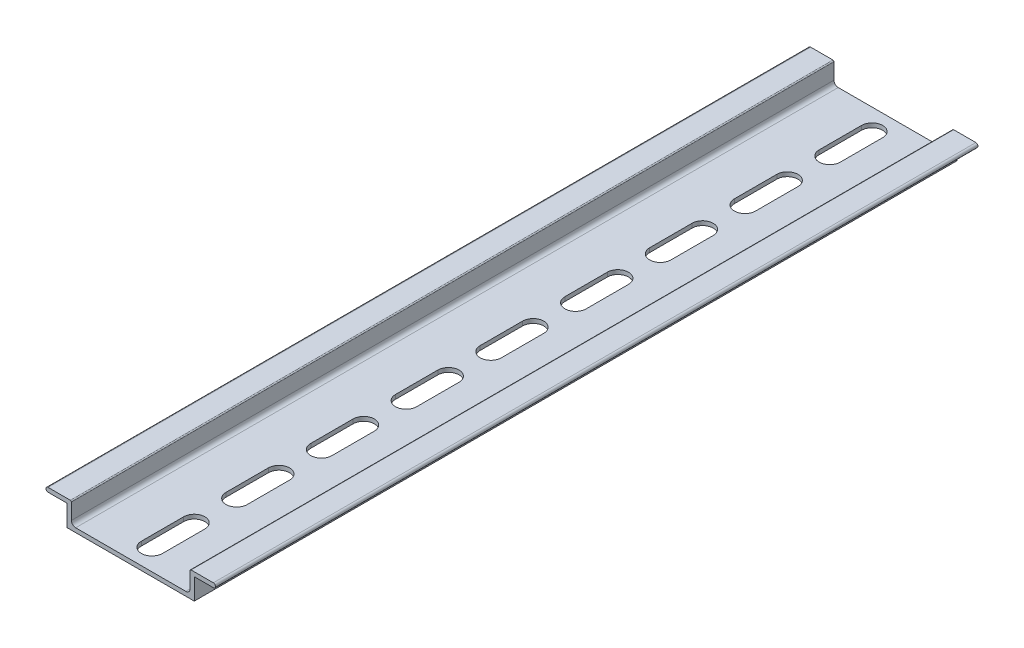
from build123d import *

# Parameters (mm, degrees)
EXTRUDE_THIN1_DEPTH = 90
FILLET1_R           = 1
FILLET2_R           = 0.25
FILLET3_RADIUS      = 0.5
FILLET3_LENGTH      = 180
FILLET4_RADIUS      = 0.5
FILLET4_LENGTH      = 180
CUT_EXTRUDE1_DEPTH  = 93.330926563
LPATTERN1_COUNT     = 5
LPATTERN1_PITCH     = 20
LPATTERN1_COL_COUNT = 5
LPATTERN1_COL_PITCH = 20


with BuildPart() as part:
    # Sketch1 → Extrude-Thin1 (new, symmetric)
    with BuildSketch(Plane.XY):
        Polygon((-20, 5), (-15, 5), (-15, 0), (15, 0), (15, 5), (20, 5), (20, 6), (14, 6), (14, 1), (-14, 1), (-14, 6), (-20, 6), align=None)
    extrude(amount=EXTRUDE_THIN1_DEPTH, both=True)

    # Fillet1
    fillet1_edges = [part.edges().sort_by_distance(p)[0] for p in [
        (-14, 1, 0),
        (14, 1, 0),
    ]]
    fillet(fillet1_edges, radius=FILLET1_R)

    # Fillet2
    fillet2_edges = [part.edges().sort_by_distance(p)[0] for p in [
        (-14, 6, 0),
        (14, 6, 0),
    ]]
    fillet(fillet2_edges, radius=FILLET2_R)

    # Fillet3: full round fillet: the end face becomes a half cylinder, R = half its width
    fillet3_face = Plane((20, 5.5, 0), x_dir=(0, 0, 1), z_dir=(1, 0, 0))  # on the end face: x along it, z out of the body
    fillet3_slab = fillet3_face.offset(-FILLET3_RADIUS / 2) * Box(FILLET3_LENGTH, 2 * FILLET3_RADIUS, FILLET3_RADIUS, mode=Mode.PRIVATE)  # the body's end, R deep
    fillet3_round = Plane((19.5, 5.5, 0), x_dir=(1, 0, 0), z_dir=(0, 0, 1)) * Cylinder(FILLET3_RADIUS, FILLET3_LENGTH, mode=Mode.PRIVATE)  # its axis R under the face
    add(fillet3_slab - fillet3_round, mode=Mode.SUBTRACT)

    # Fillet4: full round fillet: the end face becomes a half cylinder, R = half its width
    fillet4_face = Plane((-20, 5.5, 0), x_dir=(0, 0, 1), z_dir=(-1, 0, 0))  # on the end face: x along it, z out of the body
    fillet4_slab = fillet4_face.offset(-FILLET4_RADIUS / 2) * Box(FILLET4_LENGTH, 2 * FILLET4_RADIUS, FILLET4_RADIUS, mode=Mode.PRIVATE)  # the body's end, R deep
    fillet4_round = Plane((-19.5, 5.5, 0), x_dir=(-1, 0, 0), z_dir=(0, 0, 1)) * Cylinder(FILLET4_RADIUS, FILLET4_LENGTH, mode=Mode.PRIVATE)  # its axis R under the face
    add(fillet4_slab - fillet4_round, mode=Mode.SUBTRACT)

    # Sketch2 → Cut-Extrude1 (cut, through all)
    with BuildSketch(Plane(origin=(0, 1, 0), x_dir=(1, 0, 0), z_dir=(0, 1, 0))):
        with BuildLine():
            Line((-2.5, -5), (-2.5, 5))
            ThreePointArc((-2.5, 5), (0, 7.5), (2.5, 5))
            Line((2.5, 5), (2.5, -5))
            ThreePointArc((2.5, -5), (0, -7.5), (-2.5, -5))
        make_face()
    cut_extrude1 = extrude(amount=-CUT_EXTRUDE1_DEPTH, mode=Mode.SUBTRACT)

    # LPattern1: Cut-Extrude1 ×5
    with Locations(*[(0, 0, -i * LPATTERN1_PITCH) for i in range(1, LPATTERN1_COUNT)]):
        add(cut_extrude1, mode=Mode.SUBTRACT)

    # LPattern1 col: Cut-Extrude1 ×5
    with Locations(*[(0, 0, i * LPATTERN1_COL_PITCH) for i in range(1, LPATTERN1_COL_COUNT)]):
        add(cut_extrude1, mode=Mode.SUBTRACT)


solid = part.part
